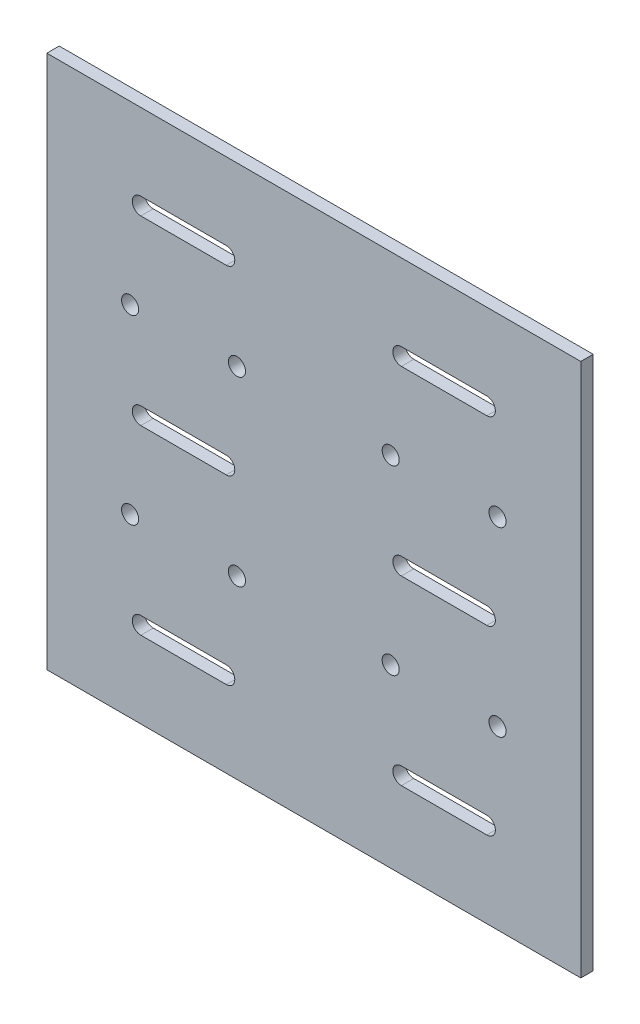
from build123d import *

# Parameters (mm, degrees)
SKETCH_1_W          = 250
SKETCH_1_H          = 250
EXTRUDE_1_DEPTH     = 5.8
CUT_EXTRUDE_1_REACH = 355.601
SKETCH_2_R          = 4


with BuildPart() as part:
    # Эскиз1 → Бобышка-Вытянуть1 (new body)
    with BuildSketch(Plane.XY):
        with Locations((125, 125)):
            Rectangle(SKETCH_1_W, SKETCH_1_H)
        with BuildLine():
            Line((44, 214), (84, 214))
            ThreePointArc((84, 214), (88, 210), (84, 206))
            Line((84, 206), (44, 206))
            ThreePointArc((44, 206), (40, 210), (44, 214))
        make_face(mode=Mode.SUBTRACT)
        with BuildLine():
            Line((166, 214), (206, 214))
            ThreePointArc((206, 214), (210, 210), (206, 206))
            Line((206, 206), (166, 206))
            ThreePointArc((166, 206), (162, 210), (166, 214))
        make_face(mode=Mode.SUBTRACT)
        with BuildLine():
            Line((166, 129), (206, 129))
            ThreePointArc((206, 129), (210, 125), (206, 121))
            Line((206, 121), (166, 121))
            ThreePointArc((166, 121), (162, 125), (166, 129))
        make_face(mode=Mode.SUBTRACT)
        with BuildLine():
            Line((166, 44), (206, 44))
            ThreePointArc((206, 44), (210, 40), (206, 36))
            Line((206, 36), (166, 36))
            ThreePointArc((166, 36), (162, 40), (166, 44))
        make_face(mode=Mode.SUBTRACT)
        with BuildLine():
            Line((44, 129), (84, 129))
            ThreePointArc((84, 129), (88, 125), (84, 121))
            Line((84, 121), (44, 121))
            ThreePointArc((44, 121), (40, 125), (44, 129))
        make_face(mode=Mode.SUBTRACT)
        with BuildLine():
            Line((44, 44), (84, 44))
            ThreePointArc((84, 44), (88, 40), (84, 36))
            Line((84, 36), (44, 36))
            ThreePointArc((44, 36), (40, 40), (44, 44))
        make_face(mode=Mode.SUBTRACT)
    extrude(amount=EXTRUDE_1_DEPTH)

    # Эскиз2 → Вырез-Вытянуть1 (cut, up to next)
    with BuildSketch(Plane.XY.offset(5.8), mode=Mode.PRIVATE) as cut_extrude_1_sk1:
        with Locations((39, 167.5)):
            Circle(SKETCH_2_R)
    cut_extrude_1_tool1 = extrude(cut_extrude_1_sk1.sketch, amount=-CUT_EXTRUDE_1_REACH, mode=Mode.PRIVATE) & part.part
    # Эскиз2 → Вырез-Вытянуть1 (cut, up to next)
    with BuildSketch(Plane.XY.offset(5.8), mode=Mode.PRIVATE) as cut_extrude_1_sk2:
        with Locations((89, 167.5)):
            Circle(SKETCH_2_R)
    cut_extrude_1_tool2 = extrude(cut_extrude_1_sk2.sketch, amount=-CUT_EXTRUDE_1_REACH, mode=Mode.PRIVATE) & part.part
    # Эскиз2 → Вырез-Вытянуть1 (cut, up to next)
    with BuildSketch(Plane.XY.offset(5.8), mode=Mode.PRIVATE) as cut_extrude_1_sk3:
        with Locations((39, 82.5)):
            Circle(SKETCH_2_R)
    cut_extrude_1_tool3 = extrude(cut_extrude_1_sk3.sketch, amount=-CUT_EXTRUDE_1_REACH, mode=Mode.PRIVATE) & part.part
    # Эскиз2 → Вырез-Вытянуть1 (cut, up to next)
    with BuildSketch(Plane.XY.offset(5.8), mode=Mode.PRIVATE) as cut_extrude_1_sk4:
        with Locations((89, 82.5)):
            Circle(SKETCH_2_R)
    cut_extrude_1_tool4 = extrude(cut_extrude_1_sk4.sketch, amount=-CUT_EXTRUDE_1_REACH, mode=Mode.PRIVATE) & part.part
    # Эскиз2 → Вырез-Вытянуть1 (cut, up to next)
    with BuildSketch(Plane.XY.offset(5.8), mode=Mode.PRIVATE) as cut_extrude_1_sk5:
        with Locations((161, 82.5)):
            Circle(SKETCH_2_R)
    cut_extrude_1_tool5 = extrude(cut_extrude_1_sk5.sketch, amount=-CUT_EXTRUDE_1_REACH, mode=Mode.PRIVATE) & part.part
    # Эскиз2 → Вырез-Вытянуть1 (cut, up to next)
    with BuildSketch(Plane.XY.offset(5.8), mode=Mode.PRIVATE) as cut_extrude_1_sk6:
        with Locations((161, 167.5)):
            Circle(SKETCH_2_R)
    cut_extrude_1_tool6 = extrude(cut_extrude_1_sk6.sketch, amount=-CUT_EXTRUDE_1_REACH, mode=Mode.PRIVATE) & part.part
    # Эскиз2 → Вырез-Вытянуть1 (cut, up to next)
    with BuildSketch(Plane.XY.offset(5.8), mode=Mode.PRIVATE) as cut_extrude_1_sk7:
        with Locations((211, 167.5)):
            Circle(SKETCH_2_R)
    cut_extrude_1_tool7 = extrude(cut_extrude_1_sk7.sketch, amount=-CUT_EXTRUDE_1_REACH, mode=Mode.PRIVATE) & part.part
    # Эскиз2 → Вырез-Вытянуть1 (cut, up to next)
    with BuildSketch(Plane.XY.offset(5.8), mode=Mode.PRIVATE) as cut_extrude_1_sk8:
        with Locations((211, 82.5)):
            Circle(SKETCH_2_R)
    cut_extrude_1_tool8 = extrude(cut_extrude_1_sk8.sketch, amount=-CUT_EXTRUDE_1_REACH, mode=Mode.PRIVATE) & part.part
    add(cut_extrude_1_tool1.solids().sort_by_distance((39, 167.5, 5.8))[0], mode=Mode.SUBTRACT)
    add(cut_extrude_1_tool2.solids().sort_by_distance((89, 167.5, 5.8))[0], mode=Mode.SUBTRACT)
    add(cut_extrude_1_tool3.solids().sort_by_distance((39, 82.5, 5.8))[0], mode=Mode.SUBTRACT)
    add(cut_extrude_1_tool4.solids().sort_by_distance((89, 82.5, 5.8))[0], mode=Mode.SUBTRACT)
    add(cut_extrude_1_tool5.solids().sort_by_distance((161, 82.5, 5.8))[0], mode=Mode.SUBTRACT)
    add(cut_extrude_1_tool6.solids().sort_by_distance((161, 167.5, 5.8))[0], mode=Mode.SUBTRACT)
    add(cut_extrude_1_tool7.solids().sort_by_distance((211, 167.5, 5.8))[0], mode=Mode.SUBTRACT)
    add(cut_extrude_1_tool8.solids().sort_by_distance((211, 82.5, 5.8))[0], mode=Mode.SUBTRACT)


solid = part.part
